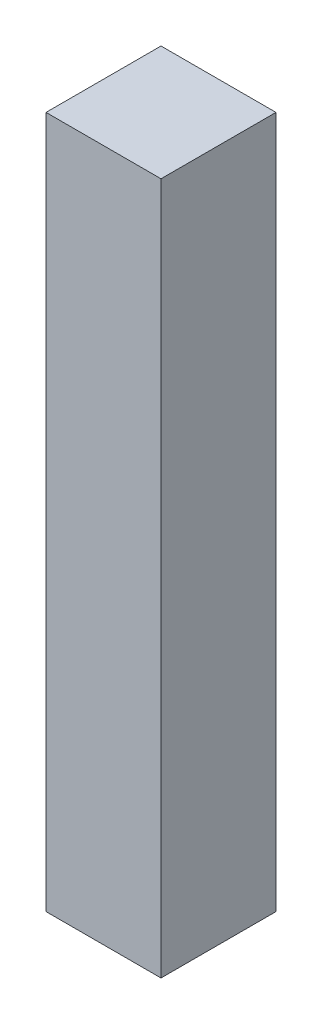
from build123d import *

# Parameters (mm, degrees)
SKETCH_1_W      = 20
SKETCH_1_H      = 20
EXTRUDE_1_DEPTH = 120.4


with BuildPart() as part:
    # 草图1 → 凸台-拉伸1 (new body)
    with BuildSketch(Plane(origin=(0, 0, 0), x_dir=(1, 0, 0), z_dir=(0, 1, 0))):
        Rectangle(SKETCH_1_W, SKETCH_1_H)
    extrude(amount=EXTRUDE_1_DEPTH)


solid = part.part
